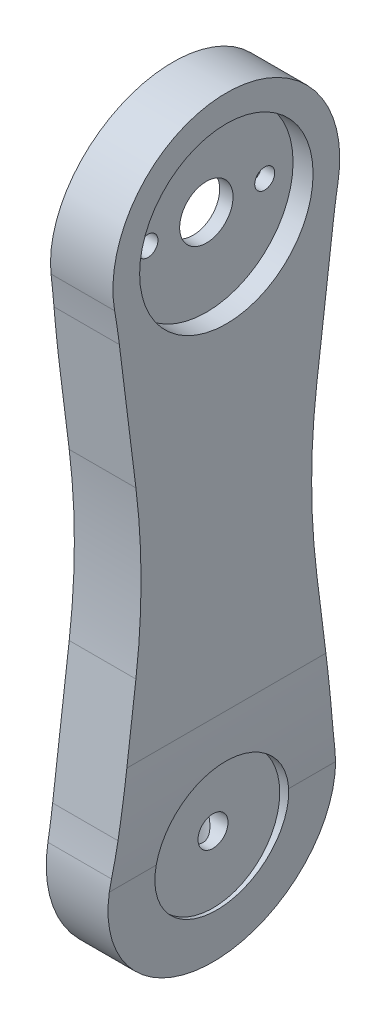
from build123d import *

# Parameters (mm, degrees)
SALIENTE_EXTRUIR1_DEPTH     = 10
CROQUIS3_R                  = 10
CORTAR_EXTRUIR1_DEPTH       = 2
CORTAR_EXTRUIR5_START       = -10
CROQUIS7_R                  = 2.25
CORTAR_EXTRUIR5_DEPTH       = 55.115174372
CROQUIS8_R                  = 2.5
CORTAR_EXTRUIR6_DEPTH       = 19
CORTAR_EXTRUIR19_START      = -11
CROQUIS12_R                 = 3.5
CORTAR_EXTRUIR19_DEPTH      = 5
CORTAR_EXTRUIR20_DEPTH      = 99.634499619
CORTAR_EXTRUIR20_DEPTH_BACK = 99.634499619
CROQUIS13_R                 = 4
CROQUIS13_R_2               = 1.5
CROQUIS17_R                 = 13
CORTAR_EXTRUIR22_DEPTH      = 5
CORTAR_EXTRUIR23_START      = -3
CROQUIS15_R                 = 13
CORTAR_EXTRUIR23_DEPTH      = 3
CORTAR_EXTRUIR24_DEPTH      = 99.816823039
CORTAR_EXTRUIR24_DEPTH_BACK = 99.816823039
CROQUIS18_OUTSIDE_W         = 35.844
CROQUIS18_OUTSIDE_H         = 139.673


with BuildPart() as part:
    # Croquis1 → Saliente-Extruir1 (new body)
    with BuildSketch(Plane(origin=(0, 0, 0), x_dir=(0, 0, -1), z_dir=(1, 0, 0))):
        with BuildLine():
            Line((-16.039395606, 7.658342494), (-13.557839382, 27.510792285))
            ThreePointArc((-13.557839382, 27.510792285), (-12.978866844, 33.700521588), (-12.785627053, 39.914265744))
            Line((-12.785627053, 39.914265744), (12.785627053, 39.914265744))
            ThreePointArc((12.785627053, 39.914265744), (12.978866844, 33.700521588), (13.557839382, 27.510792285))
            Line((13.557839382, 27.510792285), (16.039395606, 7.658342494))
            ThreePointArc((16.039395606, 7.658342494), (16.365368489, 5.282403528), (16.748223211, 2.914964711))
            ThreePointArc((16.748223211, 2.914964711), (0, -17), (-16.748223211, 2.914964711))
            ThreePointArc((-16.748223211, 2.914964711), (-16.365368489, 5.282403528), (-16.039395606, 7.658342494))
        make_face()
    saliente_extruir1 = extrude(amount=-SALIENTE_EXTRUIR1_DEPTH)

    # Croquis3 → Cortar-Extruir1 (cut)
    with BuildSketch(Plane(origin=(0, 0, 0), x_dir=(0, 0, -1), z_dir=(1, 0, 0))):
        Circle(CROQUIS3_R)
    cortar_extruir1 = extrude(amount=-CORTAR_EXTRUIR1_DEPTH, mode=Mode.SUBTRACT)

    # Croquis7 → Cortar-Extruir5 (cut)
    with BuildSketch(Plane(origin=(-2, 0, 0), x_dir=(0, 0, -1), z_dir=(1, 0, 0)).offset(CORTAR_EXTRUIR5_START)):
        with Locations(Location((0, 0, 0), (0, 0, 180))):
            Circle(CROQUIS7_R)
    cortar_extruir5 = extrude(amount=CORTAR_EXTRUIR5_DEPTH, mode=Mode.SUBTRACT)

    # Croquis8 → Cortar-Extruir6 (cut)
    with BuildSketch(Plane(origin=(0, 0, 0), x_dir=(1, 0, 0), z_dir=(0, 1, 0))):
        with Locations(Location((-6, 0, 0), (0, 0, 270))):
            Circle(CROQUIS8_R)
    extrude(amount=-CORTAR_EXTRUIR6_DEPTH, mode=Mode.SUBTRACT)

    # Croquis12 → Cortar-Extruir19 (cut)
    with BuildSketch(Plane(origin=(0, 0, 0), x_dir=(1, 0, 0), z_dir=(0, 1, 0)).offset(CORTAR_EXTRUIR19_START)):
        with Locations(Location((-6, 0, 0), (0, 0, 270))):
            Circle(CROQUIS12_R)
    extrude(amount=-CORTAR_EXTRUIR19_DEPTH, mode=Mode.SUBTRACT)

    # Simetría1: Saliente-Extruir1, Cortar-Extruir1, Cortar-Extruir5 across plane
    add(saliente_extruir1.mirror(Plane(origin=(-10, 39.914265744, 12.785627053), x_dir=(0, 0, 1), z_dir=(0, 1, 0))))
    add(cortar_extruir1.mirror(Plane(origin=(-10, 39.914265744, 12.785627053), x_dir=(0, 0, 1), z_dir=(0, 1, 0))), mode=Mode.SUBTRACT)
    add(cortar_extruir5.mirror(Plane(origin=(-10, 39.914265744, 12.785627053), x_dir=(0, 0, 1), z_dir=(0, 1, 0))), mode=Mode.SUBTRACT)

    # Croquis13 → Cortar-Extruir20 (cut, two sides: drawn at the far end of the back side and taken through both)
    with BuildSketch(Plane(origin=(-2, 0, 0), x_dir=(0, 0, -1), z_dir=(1, 0, 0)).offset(-CORTAR_EXTRUIR20_DEPTH_BACK)):
        with Locations((0, 79.828531488)):
            Circle(CROQUIS13_R)
        with Locations((8.75, 79.828531488)):
            Circle(CROQUIS13_R_2)
        with Locations((-8.75, 79.828531488)):
            Circle(CROQUIS13_R_2)
    extrude(amount=CORTAR_EXTRUIR20_DEPTH + CORTAR_EXTRUIR20_DEPTH_BACK, mode=Mode.SUBTRACT)

    # Croquis17 → Cortar-Extruir22 (cut)
    with BuildSketch(Plane.ZY.offset(10)):
        with Locations((0, 79.828531488)):
            Circle(CROQUIS17_R)
    extrude(amount=-CORTAR_EXTRUIR22_DEPTH, mode=Mode.SUBTRACT)

    # Croquis15 → Cortar-Extruir23 (cut)
    with BuildSketch(Plane(origin=(0, 0, 0), x_dir=(0, 0, -1), z_dir=(1, 0, 0)).offset(CORTAR_EXTRUIR23_START)):
        with Locations(Location((0, 79.828531488, 0), (0, 0, 180))):
            Circle(CROQUIS15_R)
    extrude(amount=CORTAR_EXTRUIR23_DEPTH, mode=Mode.SUBTRACT)

    # Croquis18 outside → Cortar-Extruir24 (cut, two sides: drawn at the far end of the back side and taken through both)
    with BuildSketch(Plane.XY.offset(-CORTAR_EXTRUIR24_DEPTH_BACK)):
        with Locations((-5, 39.9145)):
            Rectangle(CROQUIS18_OUTSIDE_W, CROQUIS18_OUTSIDE_H)
        with BuildLine():
            Line((-8, 96.828531488), (0, 96.828531488))
            Line((0, 96.828531488), (0, 16.62668343))
            ThreePointArc((0, 16.62668343), (-0.148203384, 8.928671381), (-0.592593895, 1.242068046))
            Line((-0.592593895, 1.242068046), (-2, -17))
            Line((-2, -17), (-10, -17))
            Line((-10, -17), (-10, 63.201848057))
            ThreePointArc((-10, 63.201848057), (-9.851796616, 70.899860107), (-9.407406105, 78.586463442))
            Line((-9.407406105, 78.586463442), (-8, 96.828531488))
        make_face(mode=Mode.SUBTRACT)
    extrude(amount=CORTAR_EXTRUIR24_DEPTH + CORTAR_EXTRUIR24_DEPTH_BACK, mode=Mode.SUBTRACT)


solid = part.part
